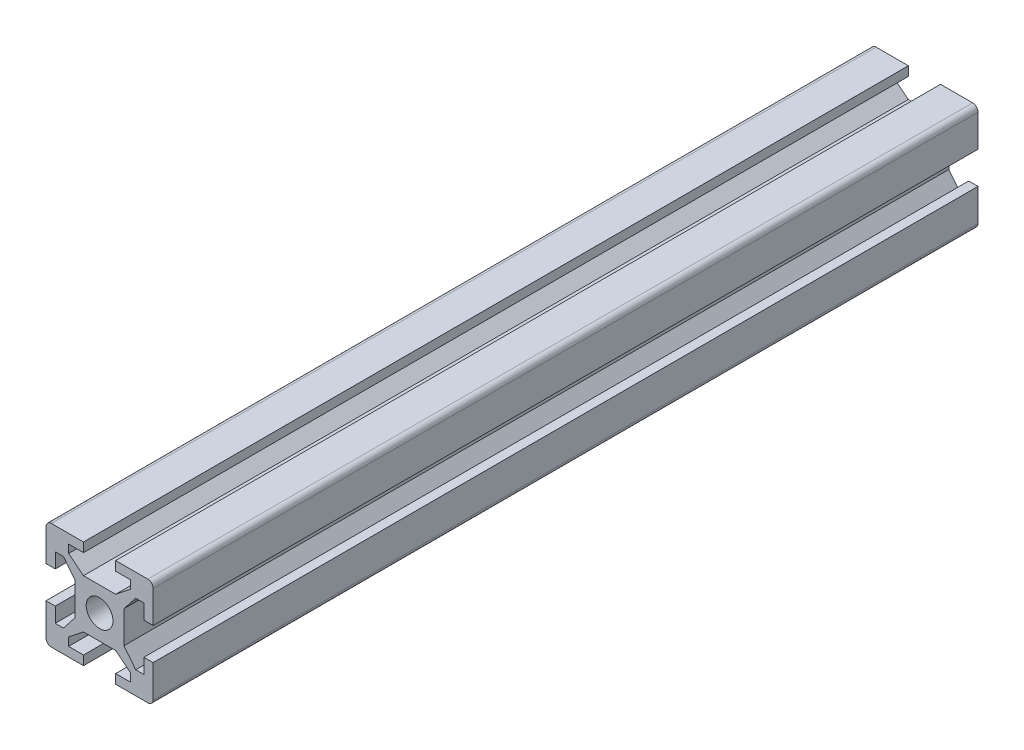
from build123d import *

# Parameters (mm, degrees)
BOSS_EXTRUDE1_DEPTH     = 77
CUT_EXTRUDE1_DEPTH      = 155.647987378
CUT_EXTRUDE1_DEPTH_BACK = 155.647987378
SKETCH2_R               = 2.5
FILLET1_R               = 1


with BuildPart() as part:
    # Sketch1 → Boss-Extrude1 (new, symmetric)
    with BuildSketch(Plane.XY):
        Polygon((-10, 10), (-3, 10), (-3, 8.272610059), (-5.783778863, 8.272610059), (-5.783778863, 6.747994248), (-3, 4.550753814), (3, 4.550753814), (5.783778863, 6.747994248), (5.783778863, 8.272610059), (3, 8.272610059), (3, 10), (10, 10), (10, 3), (8.272610059, 3), (8.272610059, 5.783778863), (6.747994248, 5.783778863), (4.55, 3.000595152), (4.55, -2.999404848), (6.747994248, -5.783778863), (8.272610059, -5.783778863), (8.272610059, -3), (10, -3), (10, -10), (3, -10), (3, -8.272610059), (5.783778863, -8.272610059), (5.783778863, -6.747994248), (2.999404848, -4.55), (-3.000595152, -4.55), (-5.783778863, -6.747994248), (-5.783778863, -8.272610059), (-3, -8.272610059), (-3, -10), (-10, -10), (-10, -3), (-8.272610059, -3), (-8.272610059, -5.783778863), (-6.747994248, -5.783778863), (-4.55, -3.000595152), (-4.55, 2.999404848), (-6.747994248, 5.783778863), (-8.272610059, 5.783778863), (-8.272610059, 3), (-10, 3), align=None)
    extrude(amount=BOSS_EXTRUDE1_DEPTH, both=True)

    # Sketch2 → Cut-Extrude1 (cut, two sides: drawn at the far end of the back side and taken through both)
    with BuildSketch(Plane.XY.offset(77).offset(-CUT_EXTRUDE1_DEPTH_BACK)):
        Circle(SKETCH2_R)
    extrude(amount=CUT_EXTRUDE1_DEPTH + CUT_EXTRUDE1_DEPTH_BACK, mode=Mode.SUBTRACT)

    # Fillet1
    fillet1_edges = [part.edges().sort_by_distance(p)[0] for p in [
        (-10, 10, 0),
        (10, 10, 0),
        (10, -10, 0),
        (-10, -10, 0),
    ]]
    fillet(fillet1_edges, radius=FILLET1_R)


solid = part.part
